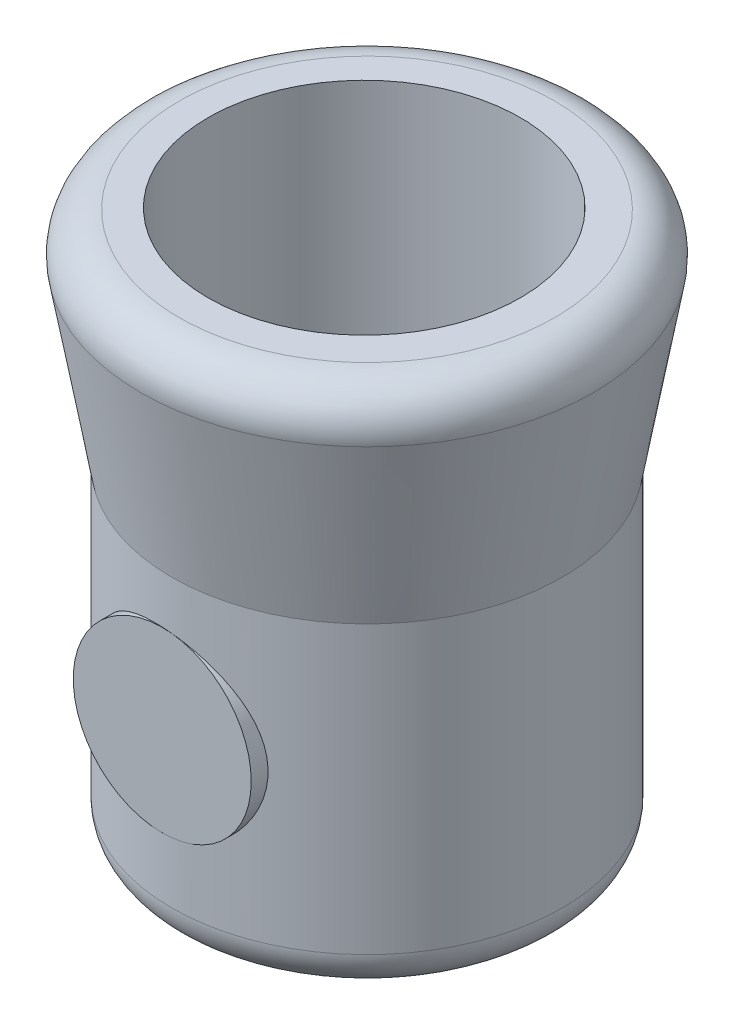
from build123d import *

# Parameters (mm, degrees)
SKETCH13_R          = 20
CUT_EXTRUDE1_DEPTH  = 29
SKETCH14_R          = 11.397429613
BOSS_EXTRUDE1_DEPTH = 25


with BuildPart() as part:
    # Sketch12 → Revolve2 (revolve)
    with BuildSketch(Plane.XY, mode=Mode.PRIVATE) as revolve2_sk:
        with BuildLine():
            Line((1.036180374, -5.869273447), (5, -28.321678322))
            Line((5, -28.321678322), (5, -65))
            ThreePointArc((5, -65), (6.464466094, -68.535533906), (10, -70))
            Line((10, -70), (30, -70))
            Line((30, -70), (30, 0))
            Line((30, 0), (5.960036959, 0))
            ThreePointArc((5.960036959, 0), (2.129477781, -1.786463571), (1.036180374, -5.869273447))
        make_face()
    revolve(revolve2_sk.sketch.rotate(Axis((30, -70, 0), (0, 1, 0)), 270), axis=Axis((30, -70, 0), (0, 1, 0)))

    # Sketch13 → Cut-Extrude1 (cut)
    with BuildSketch(Plane(origin=(0, 0, 0), x_dir=(1, 0, 0), z_dir=(0, 1, 0))):
        with Locations(Location((29.644688486, 0, 0), (0, 0, 270))):
            Circle(SKETCH13_R)
    extrude(amount=-CUT_EXTRUDE1_DEPTH, mode=Mode.SUBTRACT)

    # Sketch14 → Boss-Extrude1 (add)
    with BuildSketch(Plane.XY):
        with Locations((28.772395524, -45.877146633)):
            Circle(SKETCH14_R)
    extrude(amount=BOSS_EXTRUDE1_DEPTH)


solid = part.part
